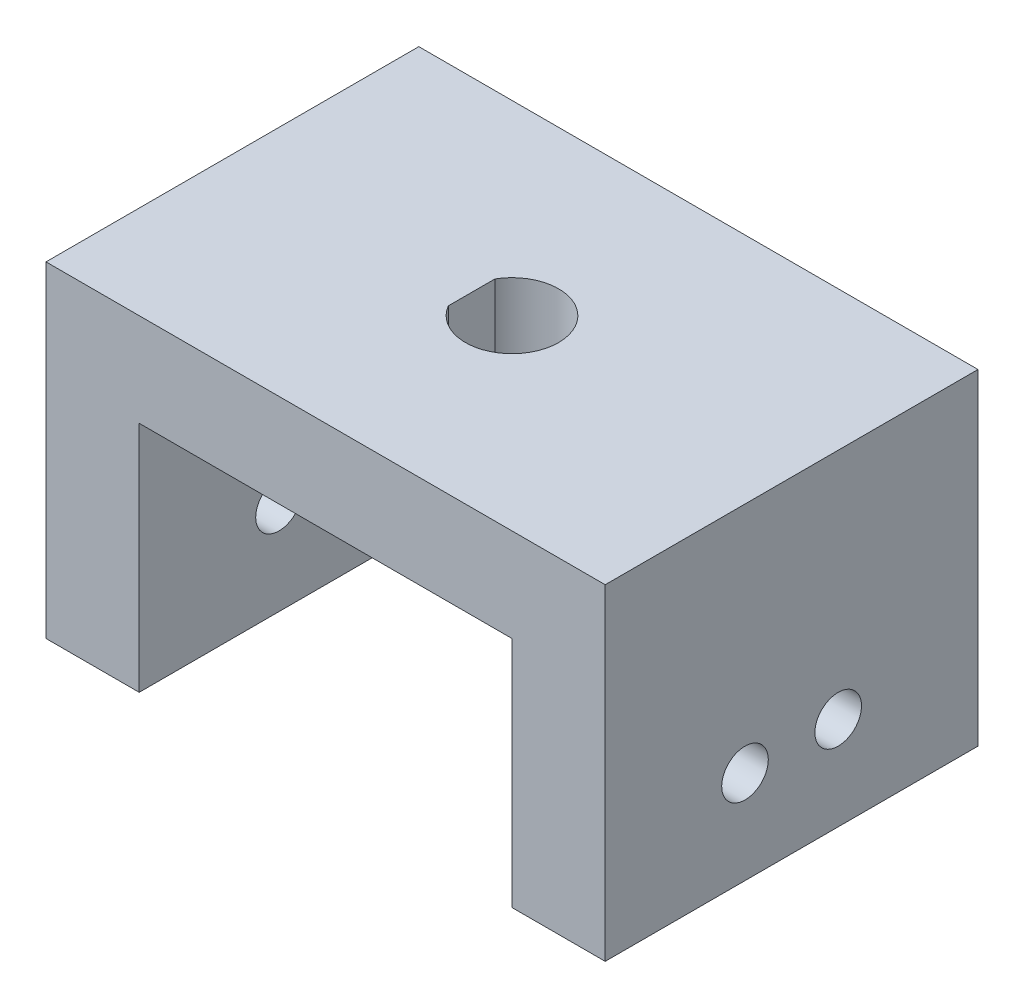
from build123d import *

# Parameters (mm, degrees)
BOSS_EXTRUDE1_DEPTH = 50.8
CUT_EXTRUDE1_REACH  = 79.512
SKETCH4_R           = 3.175
CUT_EXTRUDE2_DEPTH  = 83.8


with BuildPart() as part:
    # Sketch2 → Boss-Extrude1 (new body)
    with BuildSketch(Plane.XY):
        Polygon((38.1, 0), (-38.1, 0), (-38.1, -44.45), (-25.4, -44.45), (-25.4, -12.7), (25.4, -12.7), (25.4, -44.45), (38.1, -44.45), align=None)
    extrude(amount=BOSS_EXTRUDE1_DEPTH)

    # Sketch3 → Cut-Extrude1 (cut, up to next)
    with BuildSketch(Plane(origin=(0, 0, 0), x_dir=(1, 0, 0), z_dir=(0, 1, 0)), mode=Mode.PRIVATE) as cut_extrude1_sk1:
        with BuildLine():
            ThreePointArc((6.35, -25.4), (1.643500936, -19.266371003), (-5.499261314, -22.225))
            Line((-5.499261314, -22.225), (-5.499261314, -28.575))
            ThreePointArc((-5.499261314, -28.575), (1.643500936, -31.533628997), (6.35, -25.4))
        make_face()
    cut_extrude1_tool1 = extrude(cut_extrude1_sk1.sketch, amount=-CUT_EXTRUDE1_REACH, mode=Mode.PRIVATE) & part.part
    add(cut_extrude1_tool1.solids().sort_by_distance((0.17344, 0, 25.4))[0], mode=Mode.SUBTRACT)

    # Sketch4 → Cut-Extrude2 (cut)
    with BuildSketch(Plane.ZY.offset(38.1)):
        with Locations(Location((19.05, -31.75, 0), (0, 0, 270))):
            Circle(SKETCH4_R)
        with Locations(Location((31.75, -31.75, 0), (0, 0, 270))):
            Circle(SKETCH4_R)
    extrude(amount=-CUT_EXTRUDE2_DEPTH, mode=Mode.SUBTRACT)


solid = part.part
